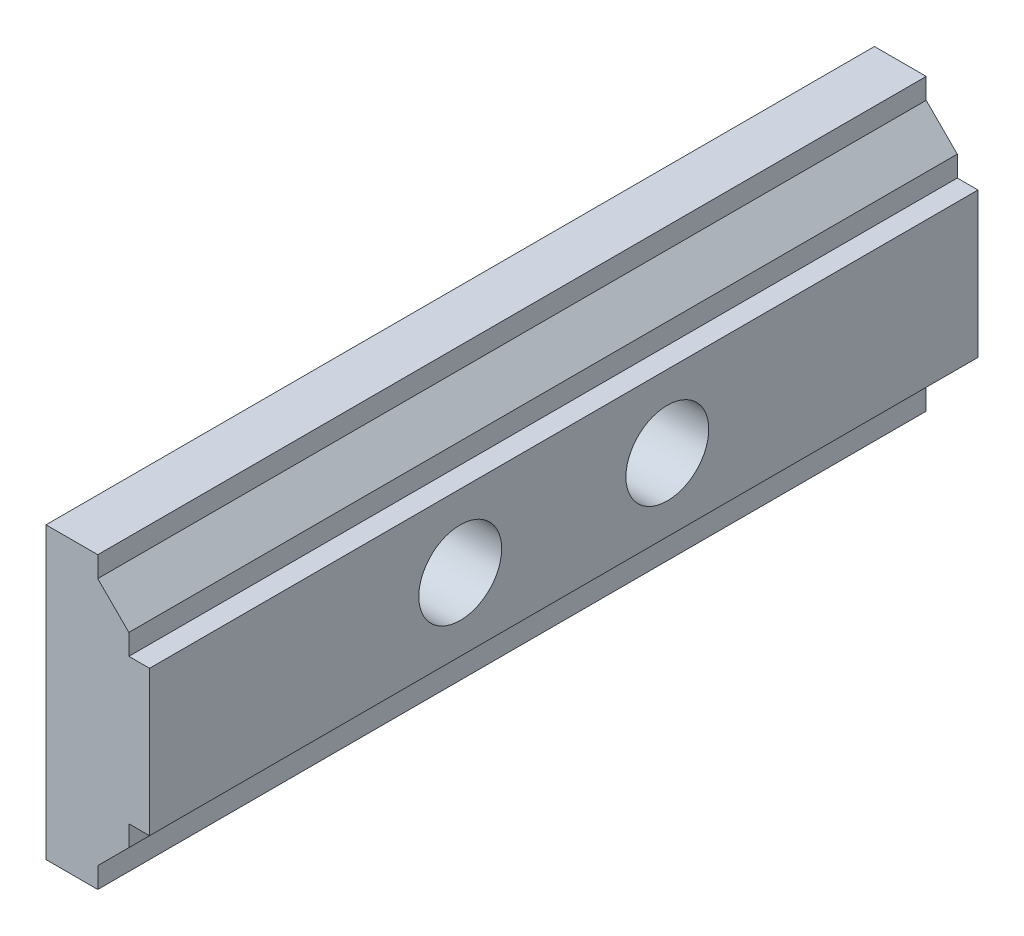
from build123d import *

# Parameters (mm, degrees)
ESBO_O1_W                = 60
ESBO_O1_H                = 12
RESSALTO_EXTRUS_O1_DEPTH = 4
ESBO_O3_W                = 25
ESBO_O3_H                = 12
CORTE_EXTRUS_O2_DEPTH    = 10
ESBO_O4_W                = 5
ESBO_O4_H                = 12
RESSALTO_EXTRUS_O2_DEPTH = 4
CORTE_EXTRUS_O3_DEPTH    = 41.644802866
ESBO_O6_W                = 40
ESBO_O6_H                = 7
RESSALTO_EXTRUS_O3_DEPTH = 1
ESBO_O2_R                = 2
CORTE_EXTRUS_O1_DEPTH    = 15
ESBO_O7_W                = 2.5
ESBO_O7_H                = 1
RESSALTO_EXTRUS_O4_DEPTH = 40


with BuildPart() as part:
    # Esboço1 → Ressalto-extrusão1 (new body)
    with BuildSketch(Plane(origin=(0, 0, 0), x_dir=(0, 0, -1), z_dir=(1, 0, 0))):
        Rectangle(ESBO_O1_W, ESBO_O1_H)
    extrude(amount=RESSALTO_EXTRUS_O1_DEPTH)

    # Esboço3 → Corte-extrusão2 (cut)
    with BuildSketch(Plane.ZY):
        with Locations((17.5, 0)):
            Rectangle(ESBO_O3_W, ESBO_O3_H)
    extrude(amount=-CORTE_EXTRUS_O2_DEPTH, mode=Mode.SUBTRACT)

    # Esboço4 → Ressalto-extrusão2 (add)
    with BuildSketch(Plane.ZY):
        with Locations((-32.5, 0)):
            Rectangle(ESBO_O4_W, ESBO_O4_H)
    extrude(amount=-RESSALTO_EXTRUS_O2_DEPTH)

    # Esboço5 → Corte-extrusão3 (cut, through all)
    with BuildSketch(Plane.XY.offset(5)):
        Polygon((4, 6), (2.5, 6), (4, 4.5), align=None)
        Polygon((4, -4.5), (4, -6), (2.5, -6), align=None)
    extrude(amount=-CORTE_EXTRUS_O3_DEPTH, mode=Mode.SUBTRACT)

    # Esboço6 → Ressalto-extrusão3 (add)
    with BuildSketch(Plane(origin=(4, 0, 0), x_dir=(0, 0, -1), z_dir=(1, 0, 0))):
        with Locations((15, 0)):
            Rectangle(ESBO_O6_W, ESBO_O6_H)
    extrude(amount=RESSALTO_EXTRUS_O3_DEPTH)

    # Esboço2 → Corte-extrusão1 (cut)
    with BuildSketch(Plane.ZY):
        with Locations((-20, 0)):
            Circle(ESBO_O2_R)
        with Locations((-10, 0)):
            Circle(ESBO_O2_R)
    extrude(amount=-CORTE_EXTRUS_O1_DEPTH, mode=Mode.SUBTRACT)

    # Esboço7 → Ressalto-extrusão4 (add)
    with BuildSketch(Plane(origin=(0, 0, -35), x_dir=(-1, 0, 0), z_dir=(0, 0, -1))):
        with Locations((-1.25, 6.5)):
            Rectangle(ESBO_O7_W, ESBO_O7_H)
        with Locations((-1.25, -6.5)):
            Rectangle(ESBO_O7_W, ESBO_O7_H)
    extrude(amount=-RESSALTO_EXTRUS_O4_DEPTH)


solid = part.part
